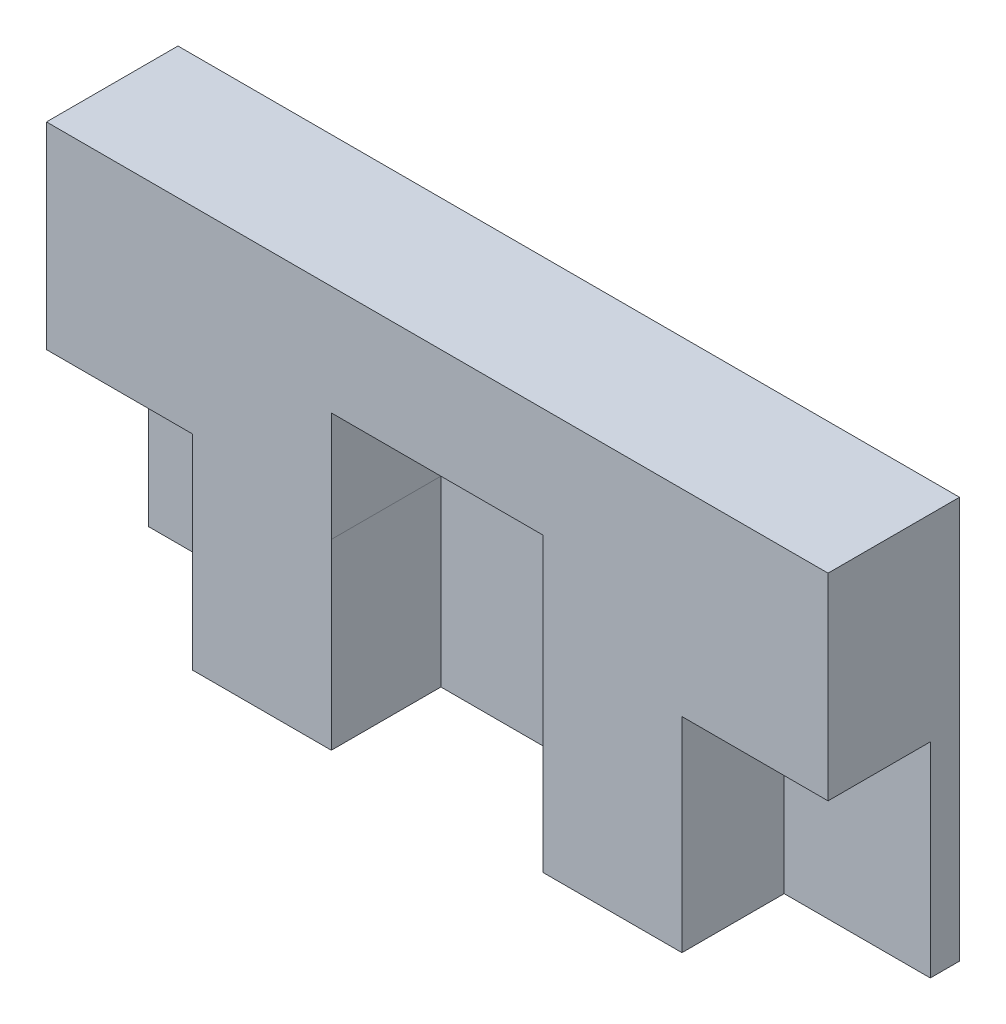
from build123d import *

# Parameters (mm, degrees)
SKETCH1_W           = 679.45
SKETCH1_H           = 114.3
BOSS_EXTRUDE1_DEPTH = 349.25
SKETCH4_W           = 184.15
SKETCH4_H           = 95.25
SKETCH5_W           = 127
SKETCH5_H           = 88.9
CUT_EXTRUDE1_DEPTH  = 177.8


with BuildPart() as part:
    # Sketch1 → Boss-Extrude1 (new body)
    with BuildSketch(Plane(origin=(0, 0, 0), x_dir=(1, 0, 0), z_dir=(0, 1, 0))):
        with Locations((0, 57.15)):
            Rectangle(SKETCH1_W, SKETCH1_H)
    extrude(amount=BOSS_EXTRUDE1_DEPTH)

    # Cut-Sweep4: sweep along a path in Sketch2
    with BuildLine(Plane(origin=(0, 0, 0), x_dir=(0, 0, -1), z_dir=(1, 0, 0))) as cut_sweep4_path:
        Line((47.625, 0), (47.625, 158.75))
        ThreePointArc((47.625, 158.75), (33.675960454, 192.425960454), (0, 206.375))
        Line((0, 206.375), (-25.4, 206.375))
    # Sketch4 → Cut-Sweep4 (sweep, cut)
    with BuildSketch(Plane(origin=(0, 0, 0), x_dir=(1, 0, 0), z_dir=(0, 1, 0))):
        with Locations((0, 47.625)):
            Rectangle(SKETCH4_W, SKETCH4_H)
    sweep(path=cut_sweep4_path.line, mode=Mode.SUBTRACT)

    # Sketch5 → Cut-Extrude1 (cut)
    with BuildSketch(Plane(origin=(0, 0, 0), x_dir=(1, 0, 0), z_dir=(0, 1, 0))):
        with Locations((-276.225, 44.45)):
            Rectangle(SKETCH5_W, SKETCH5_H)
        with Locations((276.225, 44.45)):
            Rectangle(SKETCH5_W, SKETCH5_H)
    extrude(amount=CUT_EXTRUDE1_DEPTH, mode=Mode.SUBTRACT)


solid = part.part
